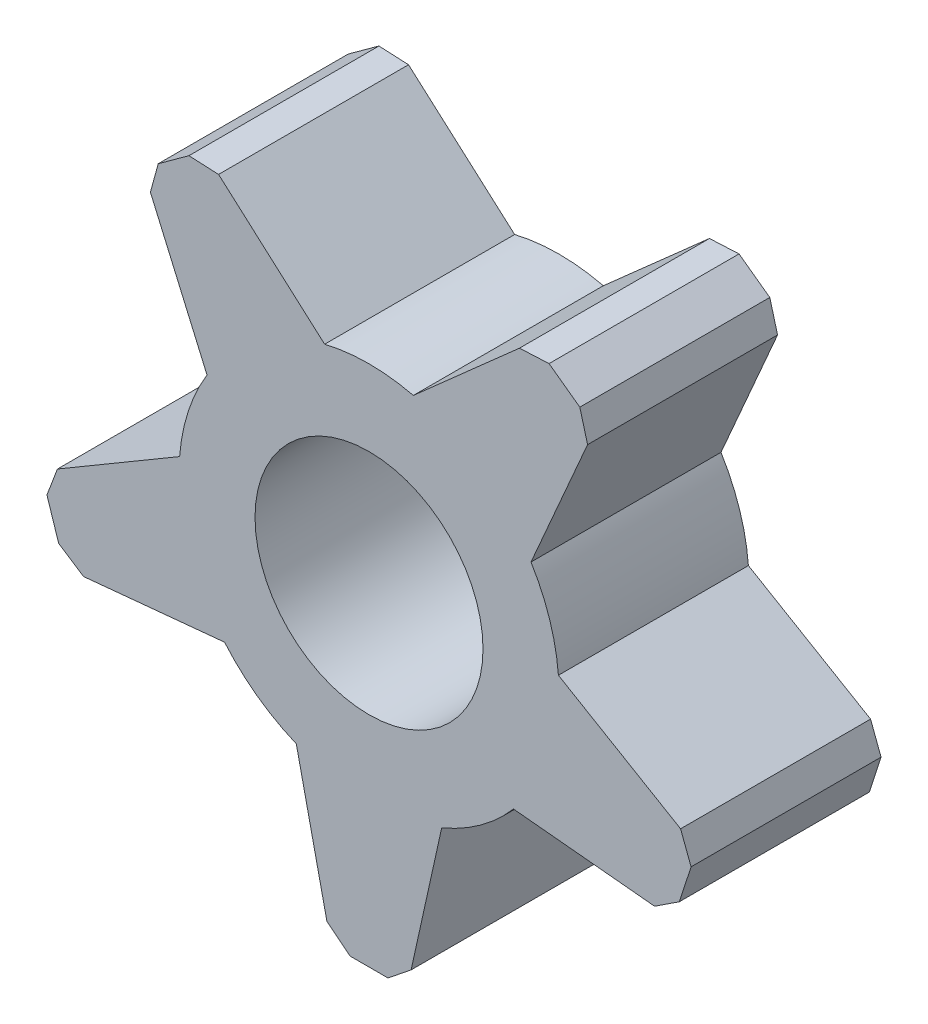
from build123d import *

# Parameters (mm, degrees)
BOSS_EXTRUDE1_DEPTH      = 5
BOSS_EXTRUDE1_DEPTH_BACK = 5
SKETCH1_R                = 6


with BuildPart() as part:
    # Sketch1 → Boss-Extrude1 (new, two sides: drawn at the far end of the back side and taken through both)
    with BuildSketch(Plane.XY.offset(-BOSS_EXTRUDE1_DEPTH_BACK)):
        with BuildLine():
            Line((-1, -17.5), (1, -17.5))
            Line((1, -17.5), (2.215917914, -16.523588481))
            Line((2.215917914, -16.523588481), (3.826834324, -9.238795325))
            ThreePointArc((3.826834324, -9.238795325), (5.877852523, -8.090169944), (7.604059656, -6.494480483))
            Line((7.604059656, -6.494480483), (15.030110204, -7.21353282))
            Line((15.030110204, -7.21353282), (16.334472041, -6.358853918))
            Line((16.334472041, -6.358853918), (16.95250603, -4.456740885))
            Line((16.95250603, -4.456740885), (16.399622791, -2.998606477))
            Line((16.399622791, -2.998606477), (9.969173337, 0.784590957))
            ThreePointArc((9.969173337, 0.784590957), (9.510565163, 3.090169944), (8.526401644, 5.224985647))
            Line((8.526401644, 5.224985647), (11.505036874, 12.065380019))
            Line((11.505036874, 12.065380019), (11.095258909, 13.570012149))
            Line((11.095258909, 13.570012149), (9.477224921, 14.745582654))
            Line((9.477224921, 14.745582654), (7.919606374, 14.670347759))
            Line((7.919606374, 14.670347759), (2.334453639, 9.723699204))
            ThreePointArc((2.334453639, 9.723699204), (0, 10), (-2.334453639, 9.723699204))
            Line((-2.334453639, 9.723699204), (-7.919606374, 14.670347759))
            Line((-7.919606374, 14.670347759), (-9.477224921, 14.745582654))
            Line((-9.477224921, 14.745582654), (-11.095258909, 13.570012149))
            Line((-11.095258909, 13.570012149), (-11.505036874, 12.065380019))
            Line((-11.505036874, 12.065380019), (-8.526401644, 5.224985647))
            ThreePointArc((-8.526401644, 5.224985647), (-9.510565163, 3.090169944), (-9.969173337, 0.784590957))
            Line((-9.969173337, 0.784590957), (-16.399622791, -2.998606477))
            Line((-16.399622791, -2.998606477), (-16.95250603, -4.456740885))
            Line((-16.95250603, -4.456740885), (-16.334472041, -6.358853918))
            Line((-16.334472041, -6.358853918), (-15.030110204, -7.21353282))
            Line((-15.030110204, -7.21353282), (-7.604059656, -6.494480483))
            ThreePointArc((-7.604059656, -6.494480483), (-5.877852523, -8.090169944), (-3.826834324, -9.238795325))
            Line((-3.826834324, -9.238795325), (-2.215917914, -16.523588481))
            Line((-2.215917914, -16.523588481), (-1, -17.5))
        make_face()
        Circle(SKETCH1_R, mode=Mode.SUBTRACT)
    extrude(amount=BOSS_EXTRUDE1_DEPTH + BOSS_EXTRUDE1_DEPTH_BACK)


solid = part.part
